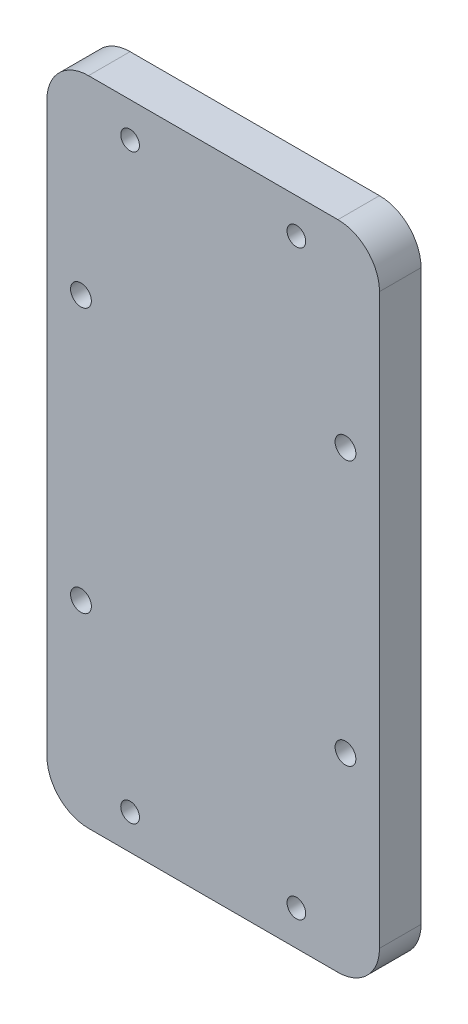
from build123d import *

# Parameters (mm, degrees)
SKETCH1_R           = 2.25
BOSS_EXTRUDE1_DEPTH = 10
M6_TAPPED_HOLE1_D   = 5


with BuildPart() as part:
    # Sketch1 → Boss-Extrude1 (new body)
    with BuildSketch(Plane(origin=(0, 0, 0), x_dir=(0, 1, 0), z_dir=(0, 0, 1))):
        with BuildLine():
            Line((68.412788105, 40), (-68.412788105, 40))
            ThreePointArc((-68.412788105, 40), (-75.483855917, 37.071067812), (-78.412788105, 30))
            Line((-78.412788105, 30), (-78.412788105, -30))
            ThreePointArc((-78.412788105, -30), (-75.483855917, -37.071067812), (-68.412788105, -40))
            Line((-68.412788105, -40), (68.412788105, -40))
            ThreePointArc((68.412788105, -40), (75.483855917, -37.071067812), (78.412788105, -30))
            Line((78.412788105, -30), (78.412788105, 30))
            ThreePointArc((78.412788105, 30), (75.483855917, 37.071067812), (68.412788105, 40))
        make_face()
        with Locations(Location((70, 20, 0), (0, 0, 270))):
            Circle(SKETCH1_R, mode=Mode.SUBTRACT)
        with Locations(Location((70, -20, 0), (0, 0, 90))):
            Circle(SKETCH1_R, mode=Mode.SUBTRACT)
        with Locations(Location((-70, -20, 0), (0, 0, 270))):
            Circle(SKETCH1_R, mode=Mode.SUBTRACT)
        with Locations(Location((-70, 20, 0), (0, 0, 90))):
            Circle(SKETCH1_R, mode=Mode.SUBTRACT)
    extrude(amount=BOSS_EXTRUDE1_DEPTH)

    # M6 Tapped Hole1 (through all)
    with Locations(Plane.XY.offset(10)):
        with Locations((-31.819805153, -31.819805153), (31.819805153, 31.819805153), (-31.819805153, 31.819805153), (31.819805153, -31.819805153)):
            Hole(M6_TAPPED_HOLE1_D / 2)


solid = part.part
